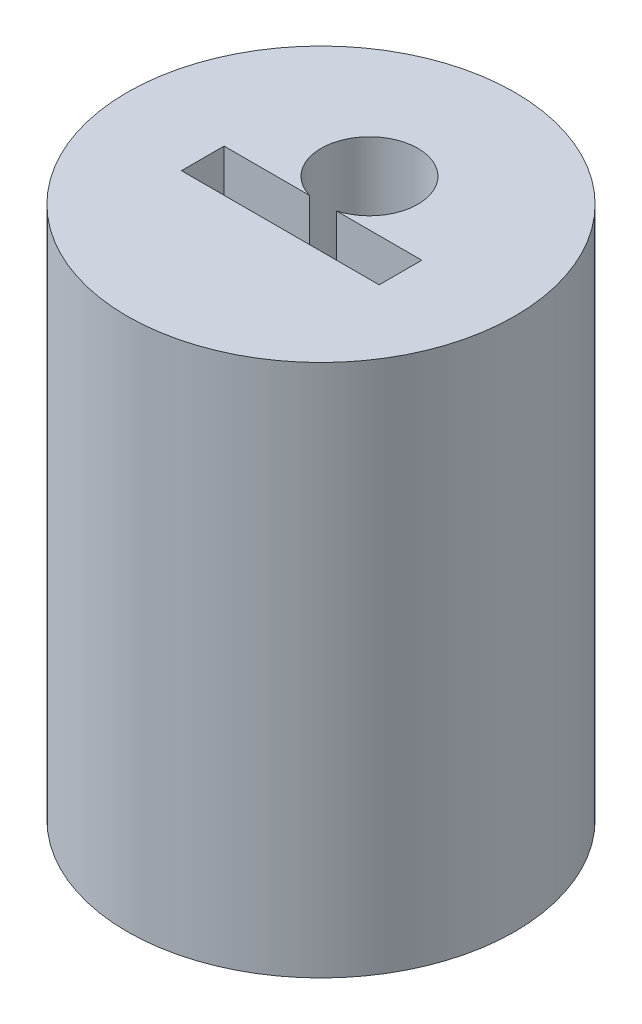
from build123d import *

# Parameters (mm, degrees)
SKETCH1_R           = 1
BOSS_EXTRUDE1_DEPTH = 1.25
SKETCH3_R           = 1
BOSS_EXTRUDE2_DEPTH = 0.25


with BuildPart() as part:
    # Sketch1 → Boss-Extrude1 (new, symmetric)
    with BuildSketch(Plane(origin=(0, 0, 0), x_dir=(1, 0, 0), z_dir=(0, 1, 0))):
        with Locations(Location((0, 0, 0), (0, 0, 270))):
            Circle(SKETCH1_R)
        with BuildLine():
            Line((-0.51, -0.21), (0.51, -0.21))
            Line((0.51, -0.21), (0.51, 0.01))
            Line((0.51, 0.01), (0.07, 0.01))
            ThreePointArc((0.07, 0.01), (0, 0.5), (-0.07, 0.01))
            Line((-0.07, 0.01), (-0.51, 0.01))
            Line((-0.51, 0.01), (-0.51, -0.21))
        make_face(mode=Mode.SUBTRACT)
    extrude(amount=BOSS_EXTRUDE1_DEPTH, both=True)

    # Sketch3 → Boss-Extrude2 (add)
    with BuildSketch(Plane.XZ.offset(1.25)):
        with Locations(Location((0, 0, 0), (0, 0, 270))):
            Circle(SKETCH3_R)
    extrude(amount=BOSS_EXTRUDE2_DEPTH)


solid = part.part
